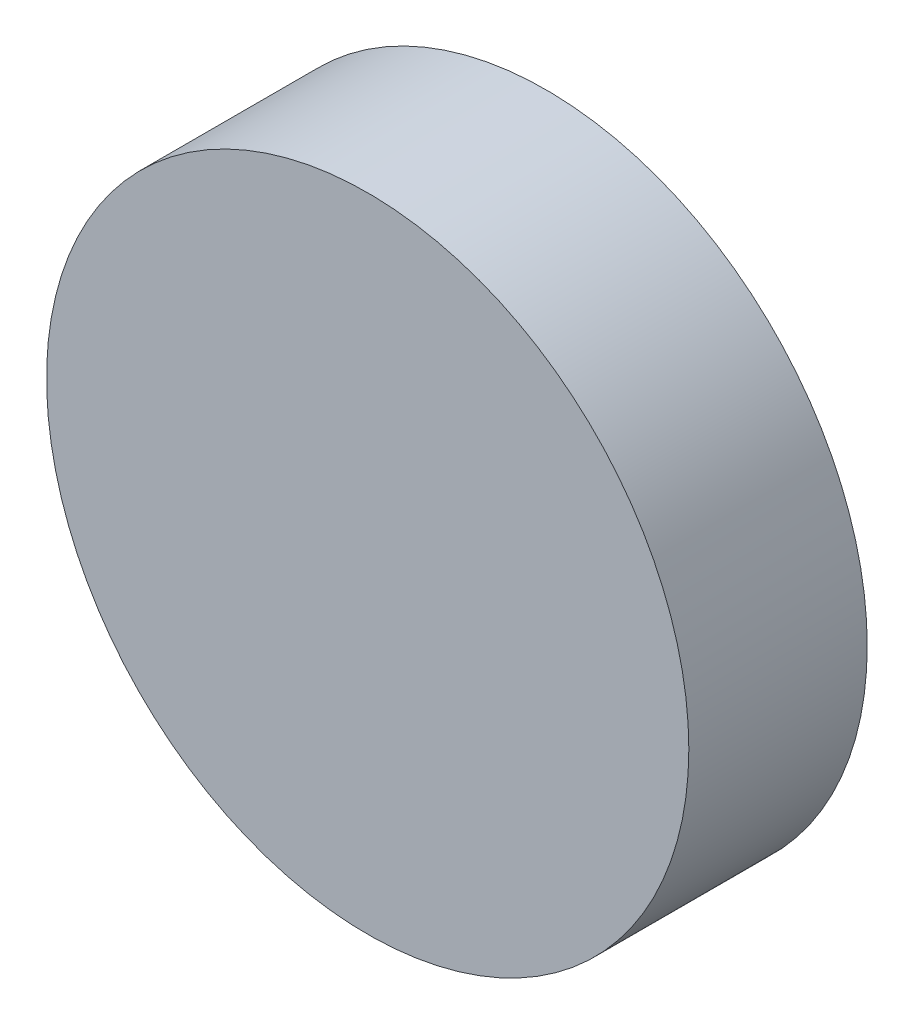
from build123d import *

# Parameters (mm, degrees)
SKETCH1_R           = 9
BOSS_EXTRUDE1_DEPTH = 5


with BuildPart() as part:
    # Sketch1 → Boss-Extrude1 (new body)
    with BuildSketch(Plane.XY):
        with Locations((40.506047888, 0.762412286)):
            Circle(SKETCH1_R)
    extrude(amount=BOSS_EXTRUDE1_DEPTH)


solid = part.part
